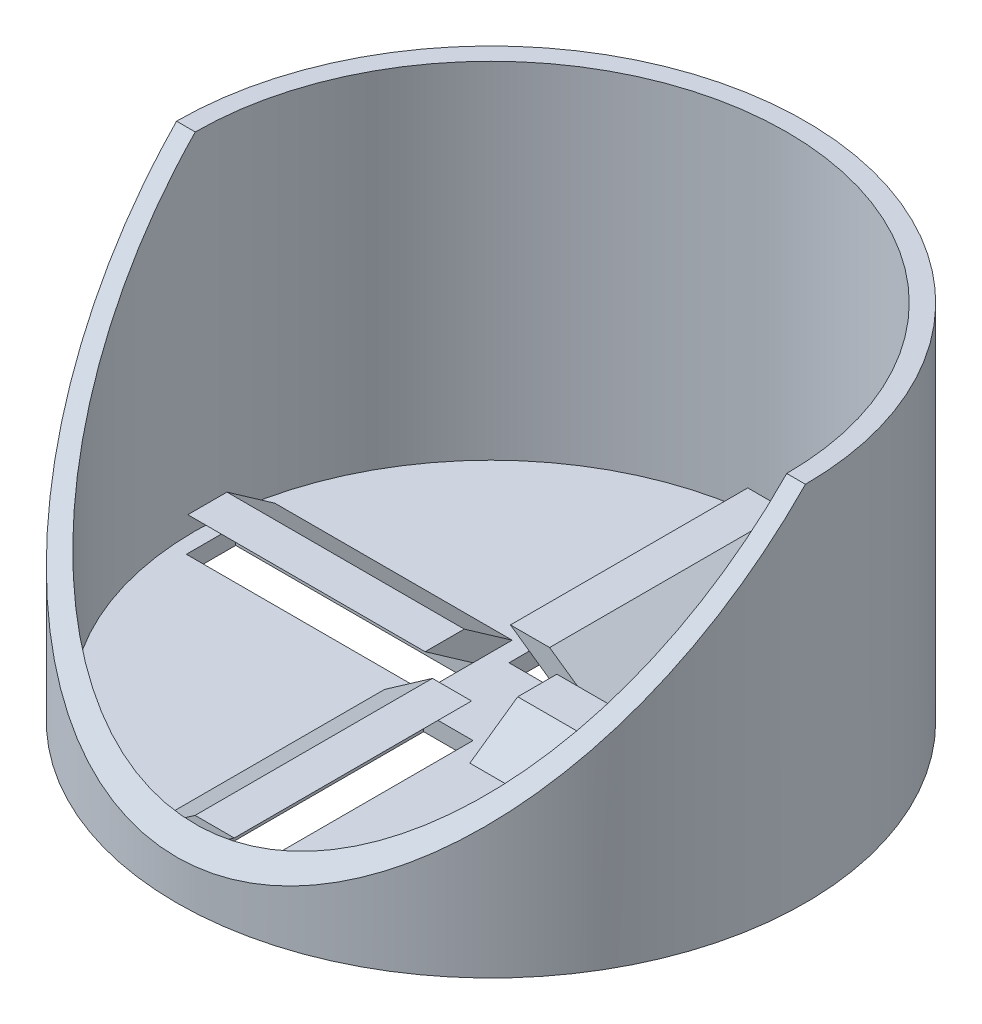
from build123d import *

# Parameters (mm, degrees)
SKETCH1_R               = 44.137005248
BOSS_EXTRUDE1_DEPTH     = 2.54
SKETCH2_W               = 7.363975328
SKETCH2_H               = 35.413609254
CUT_EXTRUDE1_DEPTH      = 2.54
BOSS_EXTRUDE2_START     = -6.36773
BOSS_EXTRUDE2_DEPTH     = 35.413609254
CIRPATTERN3_COUNT       = 4
SKETCH6_R               = 46.929171811
SKETCH6_R_2             = 44.137005248
BOSS_EXTRUDE3_DEPTH     = 54.102
CUT_EXTRUDE2_DEPTH      = 86.62546781
CUT_EXTRUDE2_DEPTH_BACK = 86.62546781


with BuildPart() as part:
    # Sketch1 → Boss-Extrude1 (new body)
    with BuildSketch(Plane(origin=(0, 0, 0), x_dir=(1, 0, 0), z_dir=(0, 1, 0))):
        with Locations(Location((0, 0, 0), (0, 0, 270))):
            Circle(SKETCH1_R)
    extrude(amount=BOSS_EXTRUDE1_DEPTH)

    # Sketch2 → Cut-Extrude1 (cut)
    with BuildSketch(Plane(origin=(0, 2.54, 0), x_dir=(1, 0, 0), z_dir=(0, 1, 0))):
        with Locations((0, 24.074534725)):
            Rectangle(SKETCH2_W, SKETCH2_H)
    cut_extrude1 = extrude(amount=-CUT_EXTRUDE1_DEPTH, mode=Mode.SUBTRACT)

    # Sketch3 → Boss-Extrude2 (add)
    with BuildSketch(Plane.XY.offset(BOSS_EXTRUDE2_START)):
        Polygon((3.681987664, 2.54), (-3.464612865, 7.544103563), (2.37831785, 7.544103563), (9.524918378, 2.54), align=None)
    boss_extrude2 = extrude(amount=-BOSS_EXTRUDE2_DEPTH)

    # CirPattern3: Cut-Extrude1, Boss-Extrude2 ×4 about axis
    cirpattern3_axis = Axis((0, 0, 0), (0, 1, 0))
    add([cut_extrude1.rotate(cirpattern3_axis, i * 360 / CIRPATTERN3_COUNT) for i in range(1, CIRPATTERN3_COUNT)], mode=Mode.SUBTRACT)
    add([boss_extrude2.rotate(cirpattern3_axis, i * 360 / CIRPATTERN3_COUNT) for i in range(1, CIRPATTERN3_COUNT)])

    # Sketch6 → Boss-Extrude3 (add)
    with BuildSketch(Plane(origin=(0, 0, 0), x_dir=(1, 0, 0), z_dir=(0, 1, 0))):
        with Locations(Location((0, 0, 0), (0, 0, 270))):
            Circle(SKETCH6_R)
        with Locations(Location((0, 0, 0), (0, 0, 270))):
            Circle(SKETCH6_R_2, mode=Mode.SUBTRACT)
    extrude(amount=BOSS_EXTRUDE3_DEPTH)

    # Sketch7 → Cut-Extrude2 (cut, two sides: drawn at the far end of the back side and taken through both)
    with BuildSketch(Plane(origin=(0, 0, 0), x_dir=(0, 0, -1), z_dir=(1, 0, 0)).offset(-CUT_EXTRUDE2_DEPTH_BACK)):
        Polygon((0, 54.102), (-46.929171811, 5.913652035), (-46.929171811, 54.102), align=None)
    extrude(amount=CUT_EXTRUDE2_DEPTH + CUT_EXTRUDE2_DEPTH_BACK, mode=Mode.SUBTRACT)


solid = part.part
